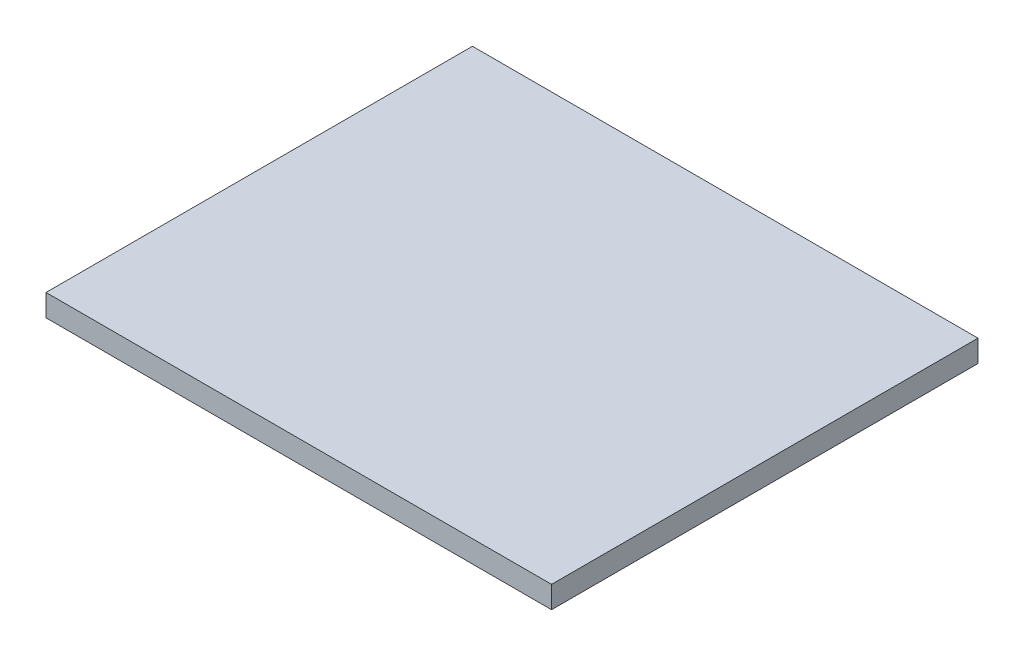
from build123d import *

# Parameters (mm, degrees)
SKETCH_1_W      = 230
SKETCH_1_H      = 194
EXTRUDE_1_DEPTH = 10


with BuildPart() as part:
    # 草图1 → 凸台-拉伸1 (new body)
    with BuildSketch(Plane(origin=(0, 0, 0), x_dir=(1, 0, 0), z_dir=(0, 1, 0))):
        with Locations((115, -97)):
            Rectangle(SKETCH_1_W, SKETCH_1_H)
    extrude(amount=EXTRUDE_1_DEPTH)


solid = part.part
